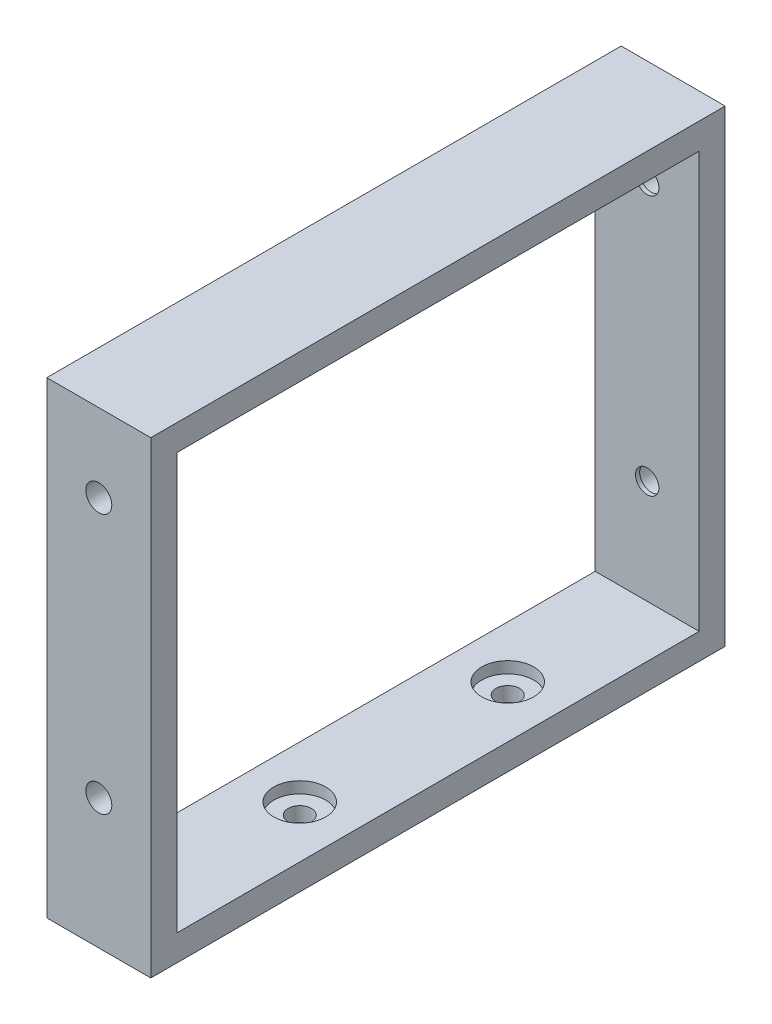
from build123d import *

# Parameters (mm, degrees)
SKETCH1_W                              = 110.475
SKETCH1_H                              = 90
SKETCH1_W_2                            = 100.475
SKETCH1_H_2                            = 80
SKETCH1_W_3                            = 5
BOSS_EXTRUDE1_DEPTH                    = 20
CBORE_FOR_M4_SBHCS1_AT_2_COUNT         = 2
CBORE_FOR_M4_SBHCS1_AT_2_PITCH         = 40
CBORE_FOR_M5_HEX_HEAD_BOLT1_AT_2_COUNT = 2
CBORE_FOR_M5_HEX_HEAD_BOLT1_AT_2_PITCH = 50
SKETCH7_W                              = 5
SKETCH7_H                              = 80
CUT_EXTRUDE1_DEPTH                     = 30


with BuildPart() as part:
    # Sketch1 → Boss-Extrude1 (new body)
    # profile 1 of 2: a face of its own
    with BuildSketch(Plane(origin=(0, 0, 0), x_dir=(0, 0, -1), z_dir=(1, 0, 0))):
        Rectangle(SKETCH1_W, SKETCH1_H)
        Rectangle(SKETCH1_W_2, SKETCH1_H_2, mode=Mode.SUBTRACT)
    # profile 2 of 2: a face of its own
    with BuildSketch(Plane(origin=(0, 0, 0), x_dir=(0, 0, -1), z_dir=(1, 0, 0))):
        with Locations((22.7375, 0)):
            Rectangle(SKETCH1_W_3, SKETCH1_H_2)
    extrude(amount=BOSS_EXTRUDE1_DEPTH)

    # Sketch3 → CBORE for M4 SBHCS1 (revolve, cut)
    with BuildSketch(Plane(origin=(10, -40, -23.4125), x_dir=(0, 0, 1), z_dir=(1, 0, 0))):
        Polygon((0, 0), (0, 9.151936393), (2.25, 7.8), (2.25, 2.2), (5, 2.2), (5, 0), align=None)
    cbore_for_m4_sbhcs1 = revolve(axis=Axis((10, -33.65, -23.4125), (0, -1, 0)), mode=Mode.SUBTRACT)

    # CBORE for M4 SBHCS1 at 2: CBORE for M4 SBHCS1 ×2
    with Locations(*[(0, 0, i * CBORE_FOR_M4_SBHCS1_AT_2_PITCH) for i in range(1, CBORE_FOR_M4_SBHCS1_AT_2_COUNT)]):
        add(cbore_for_m4_sbhcs1, mode=Mode.SUBTRACT)

    # Sketch6 → CBORE for M5 Hex Head Bolt1 (revolve, cut)
    with BuildSketch(Plane(origin=(10, 30, 55.2375), x_dir=(0, -1, 0), z_dir=(1, 0, 0))):
        Polygon((0, 0), (0, 11.451936393), (2.25, 10.1), (2.25, 4.2), (2.5, 4.2), (2.5, 0), align=None)
    cbore_for_m5_hex_head_bolt1 = revolve(axis=Axis((10, 30, 61.5875), (0, 0, -1)), mode=Mode.SUBTRACT)

    # CBORE for M5 Hex Head Bolt1 at 2: CBORE for M5 Hex Head Bolt1 ×2
    with Locations(*[(0, -i * CBORE_FOR_M5_HEX_HEAD_BOLT1_AT_2_PITCH, 0) for i in range(1, CBORE_FOR_M5_HEX_HEAD_BOLT1_AT_2_COUNT)]):
        add(cbore_for_m5_hex_head_bolt1, mode=Mode.SUBTRACT)

    # Mirror1: CBORE for M5 Hex Head Bolt1 across plane
    add(cbore_for_m5_hex_head_bolt1.mirror(Plane.XY), mode=Mode.SUBTRACT)

    # Mirror1 copy 1 sketch → Mirror1 copy 1 (revolve, cut)
    with BuildSketch(Plane(origin=(10, -20, -55.2375), x_dir=(0, -1, 0), z_dir=(1, 0, 0))):
        Polygon((0, 0), (0, -11.451936393), (2.25, -10.1), (2.25, -4.2), (2.5, -4.2), (2.5, 0), align=None)
    revolve(axis=Axis((10, -20, -61.5875), (0, 0, -1)), mode=Mode.SUBTRACT)

    # Sketch7 → Cut-Extrude1 (cut)
    with BuildSketch(Plane.ZY):
        with Locations((-22.7375, 0)):
            Rectangle(SKETCH7_W, SKETCH7_H)
    extrude(amount=-CUT_EXTRUDE1_DEPTH, mode=Mode.SUBTRACT)


solid = part.part
